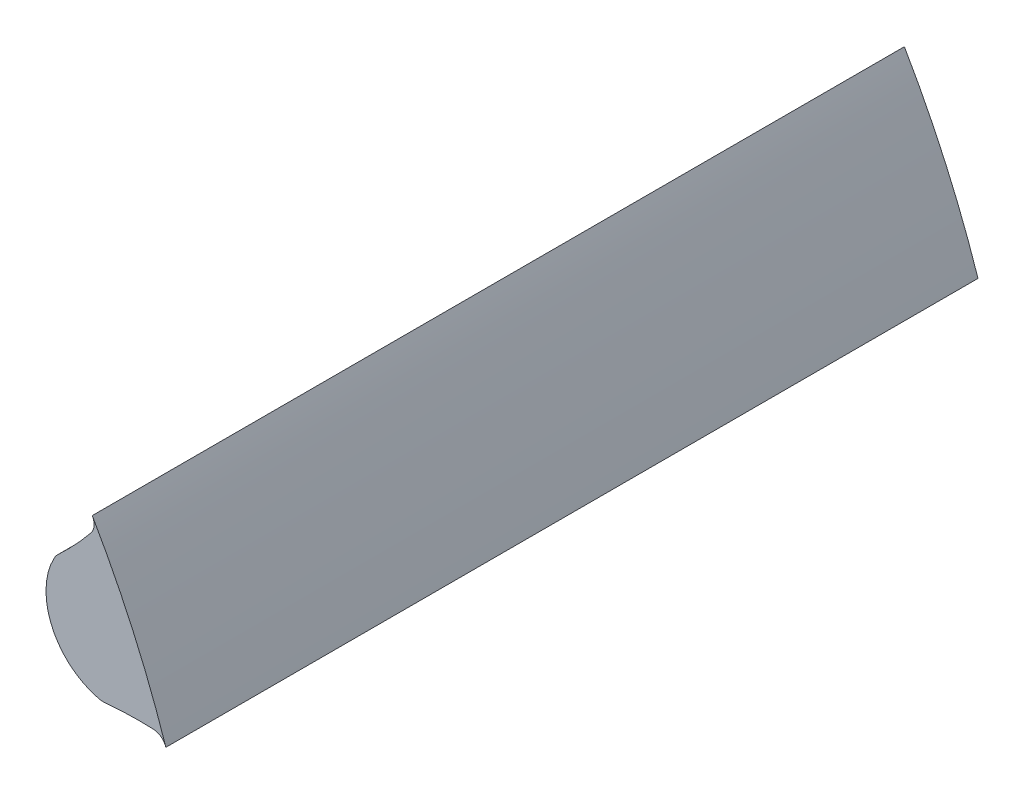
from build123d import *

# Parameters (mm, degrees)
BOSS_EXTRUDE1_DEPTH = 30


with BuildPart() as part:
    # Sketch1 → Boss-Extrude1 (new body)
    with BuildSketch(Plane.XY):
        with BuildLine():
            ThreePointArc((48.858588389, -1.179005617), (48.682545238, -0.93334219), (48.398121497, -0.83114216))
            ThreePointArc((48.398121497, -0.83114216), (47.511036789, -0.823464154), (46.625506707, -0.87651793))
            ThreePointArc((46.625506707, -0.87651793), (46.499700305, -0.877957039), (46.375371947, -0.858675408))
            ThreePointArc((46.375371947, -0.858675408), (44.653559843, 0.569806744), (44.729264572, 2.80575553))
            ThreePointArc((44.729264572, 2.80575553), (44.797426836, 2.911506311), (44.882061013, 3.004599694))
            ThreePointArc((44.882061013, 3.004599694), (45.509875566, 3.631358912), (46.093321356, 4.299617274))
            ThreePointArc((46.093321356, 4.299617274), (46.205828694, 4.580123619), (46.139102532, 4.87489358))
            ThreePointArc((46.139102532, 4.87489358), (47.654029675, 1.917654636), (48.858588389, -1.179005617))
        make_face()
    extrude(amount=BOSS_EXTRUDE1_DEPTH)


solid = part.part
